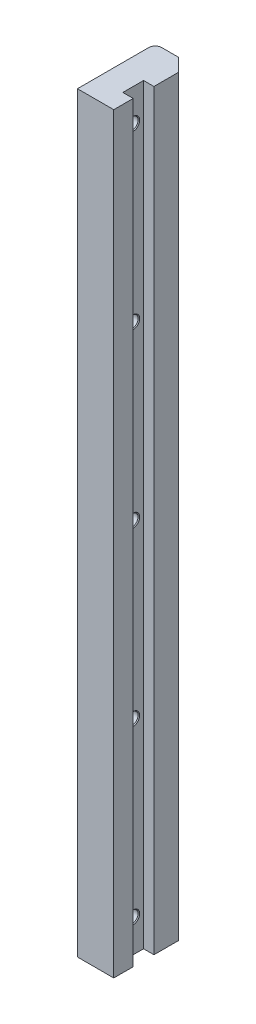
from build123d import *

# Parameters (mm, degrees)
SKETCH2_W                         = 28
SKETCH2_H                         = 60
BOSS_EXTRUDE1_DEPTH               = 290
SKETCH3_W                         = 8
SKETCH3_H                         = 16
CUT_EXTRUDE1_DEPTH                = 581.944059269
CHAMFER1_SIZE                     = 10
FILLET1_R                         = 5
M10X1_25_TAPPED_HOLE1_D           = 8.8
M10X1_25_TAPPED_HOLE1_CSINK_D     = 10.05
M10X1_25_TAPPED_HOLE1_CSINK_ANGLE = 90
LPATTERN1_COUNT                   = 5
LPATTERN1_PITCH                   = 132.5


with BuildPart() as part:
    # Sketch2 → Boss-Extrude1 (new, symmetric)
    with BuildSketch(Plane(origin=(0, 0, 0), x_dir=(-1, 0, 0), z_dir=(0, 1, 0))):
        Rectangle(SKETCH2_W, SKETCH2_H)
    extrude(amount=BOSS_EXTRUDE1_DEPTH, both=True)

    # Sketch3 → Cut-Extrude1 (cut, through all)
    with BuildSketch(Plane(origin=(0, 290, 0), x_dir=(-1, 0, 0), z_dir=(0, 1, 0))):
        with Locations((-10, 7)):
            Rectangle(SKETCH3_W, SKETCH3_H)
    extrude(amount=-CUT_EXTRUDE1_DEPTH, mode=Mode.SUBTRACT)

    # Chamfer1
    chamfer1_edges = [part.edges().sort_by_distance(p)[0] for p in [
        (14, 0, -30),
    ]]
    chamfer(chamfer1_edges, length=CHAMFER1_SIZE)

    # Fillet1
    fillet1_edges = [part.edges().sort_by_distance(p)[0] for p in [
        (-14, 0, -30),
    ]]
    fillet(fillet1_edges, radius=FILLET1_R)

    # M10x1.25 Tapped Hole1 (through all)
    with Locations(Plane.YZ.offset(6)):
        with Locations((-265, 7)):
            m10x1_25_tapped_hole1 = CounterSinkHole(M10X1_25_TAPPED_HOLE1_D / 2, M10X1_25_TAPPED_HOLE1_CSINK_D / 2, counter_sink_angle=M10X1_25_TAPPED_HOLE1_CSINK_ANGLE)

    # LPattern1: M10x1.25 Tapped Hole1 ×5
    with Locations(*[(0, i * LPATTERN1_PITCH, 0) for i in range(1, LPATTERN1_COUNT)]):
        add(m10x1_25_tapped_hole1, mode=Mode.SUBTRACT)


solid = part.part
